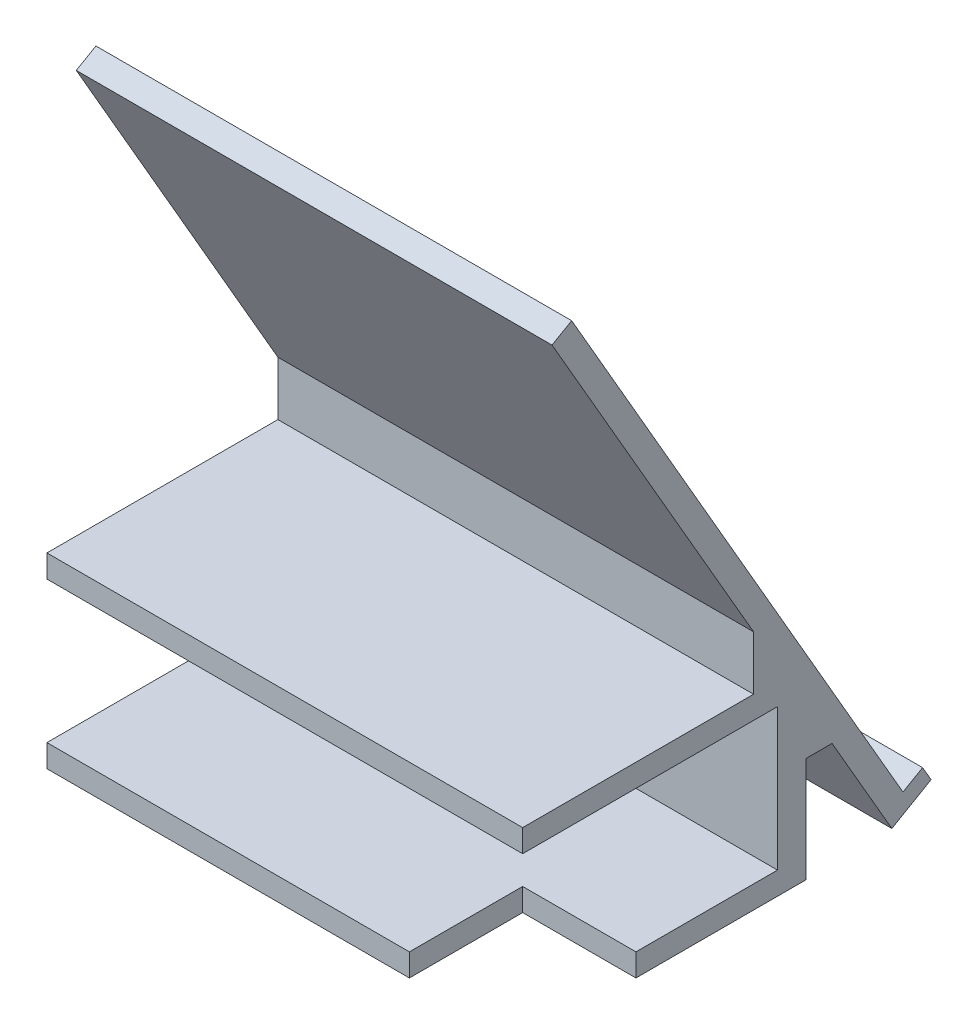
from build123d import *

# Parameters (mm, degrees)
SKETCH_1_W          = 45
SKETCH_1_H          = 4
SKETCH_1_W_2        = 5
EXTRUDE_1_DEPTH     = 84
SKETCH_2_W          = 20
SKETCH_2_H          = 20
CUT_EXTRUDE_1_DEPTH = 14
EXTRUDE_2_DEPTH     = 84


with BuildPart() as part:
    # Эскиз1 → Бобышка-Вытянуть1 (new body)
    with BuildSketch(Plane(origin=(0, 0, 0), x_dir=(0, 0, -1), z_dir=(1, 0, 0))):
        with Locations((22.5, 2)):
            Rectangle(SKETCH_1_W, SKETCH_1_H)
        with Locations((47.5, 2)):
            Rectangle(SKETCH_1_W_2, SKETCH_1_H)
        Polygon((45, 29), (45, 4), (50, 4), (50, 26.569712745), (48.596872999, 29), align=None)
        with Locations((22.5, 31)):
            Rectangle(SKETCH_1_W, SKETCH_1_H)
        Polygon((45, 33), (45, 29), (48.596872999, 29), (46.287471923, 33), align=None)
        Polygon((48.596872999, 29), (50, 26.569712745), (50, 29), align=None)
        Polygon((50, 29), (50, 26.569712745), (65.186719292, 0.265543331), (68.650820907, 2.265543331), (8.650820907, 106.188591785), (5.186719292, 104.188591785), (46.287471923, 33), (50, 33), align=None)
        Polygon((46.287471923, 33), (48.596872999, 29), (50, 29), (50, 33), align=None)
    extrude(amount=EXTRUDE_1_DEPTH)

    # Эскиз2 → Вырез-Вытянуть1 (cut)
    with BuildSketch(Plane.XZ):
        with Locations((74, -10)):
            Rectangle(SKETCH_2_W, SKETCH_2_H)
    extrude(amount=-CUT_EXTRUDE_1_DEPTH, mode=Mode.SUBTRACT)

    # Эскиз3 → Бобышка-Вытянуть2 (add)
    with BuildSketch(Plane(origin=(84, 0, 0), x_dir=(0, 0, -1), z_dir=(1, 0, 0))):
        Polygon((68.650820907, 2.265543331), (72.114922522, 4.265543331), (70.614922522, 6.863619543), (67.150820907, 4.863619543), align=None)
        Polygon((40.778226629, 42.54229276), (40.778226629, 33), (46.287471923, 33), align=None)
        Polygon((50, 26.569712745), (50, 18.552766001), (54.628586361, 18.552766001), align=None)
    extrude(amount=-EXTRUDE_2_DEPTH)


solid = part.part
